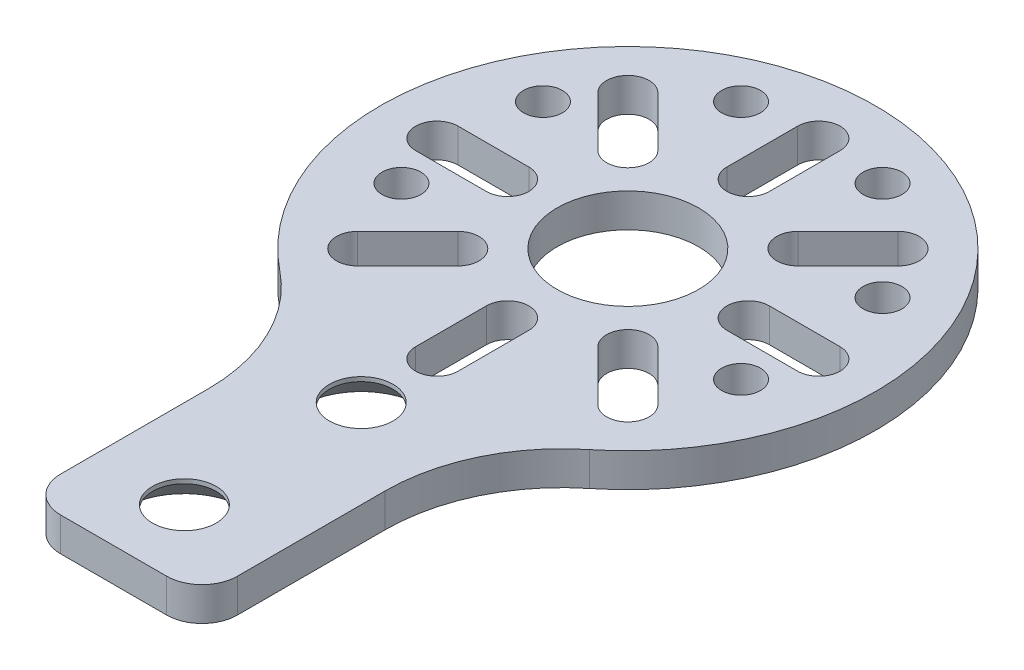
from build123d import *

# Parameters (mm, degrees)
BOSS_EXTRUDE1_DEPTH                            = 4.7625
SKETCH5_R                                      = 10
CUT_EXTRUDE1_DEPTH                             = 81.819371269
CSK_FOR_M8_FLAT_HEAD_MACHINE_SCREW1_AT_2_COUNT = 2
CSK_FOR_M8_FLAT_HEAD_MACHINE_SCREW1_AT_2_PITCH = 25
FILLET1_R                                      = 25
M5_CLEARANCE_HOLE1_D                           = 5.5
M5_CLEARANCE_HOLE1_CSINK_D                     = 5.55
M5_CLEARANCE_HOLE1_CSINK_ANGLE                 = 90
FILLET2_R                                      = 5
CUT_EXTRUDE2_DEPTH                             = 81.819371269


with BuildPart() as part:
    # Sketch1 → Boss-Extrude1 (new body)
    with BuildSketch(Plane(origin=(0, 0, 0), x_dir=(1, 0, 0), z_dir=(0, 1, 0))):
        with BuildLine():
            Line((-12.5, -72.691742077), (12.5, -72.691742077))
            Line((12.5, -72.691742077), (12.5, -32.691742077))
            ThreePointArc((12.5, -32.691742077), (0, 35), (-12.5, -32.691742077))
            Line((-12.5, -32.691742077), (-12.5, -72.691742077))
        make_face()
    extrude(amount=BOSS_EXTRUDE1_DEPTH)

    # Sketch5 → Cut-Extrude1 (cut, through all)
    with BuildSketch(Plane.XZ):
        with Locations(Location((0, 0, 0), (0, 0, 270))):
            Circle(SKETCH5_R)
    extrude(amount=-CUT_EXTRUDE1_DEPTH, mode=Mode.SUBTRACT)

    # Sketch8 → CSK for M8 Flat Head Machine Screw1 (revolve, cut)
    with BuildSketch(Plane(origin=(0, 0, 37.691742077), x_dir=(0, 0, -1), z_dir=(1, 0, 0))):
        Polygon((0, 0), (0, 4.7625), (4.5, 4.7625), (4.5, 4.15), (8.65, 0), align=None)
    csk_for_m8_flat_head_machine_screw1 = revolve(axis=Axis((0, -6.35, 37.691742077), (0, 1, 0)), mode=Mode.SUBTRACT)

    # CSK for M8 Flat Head Machine Screw1 at 2: CSK for M8 Flat Head Machine Screw1 ×2
    with Locations(*[(0, 0, i * CSK_FOR_M8_FLAT_HEAD_MACHINE_SCREW1_AT_2_PITCH) for i in range(1, CSK_FOR_M8_FLAT_HEAD_MACHINE_SCREW1_AT_2_COUNT)]):
        add(csk_for_m8_flat_head_machine_screw1, mode=Mode.SUBTRACT)

    # Fillet1
    fillet1_edges = [part.edges().sort_by_distance(p)[0] for p in [
        (-12.5, 2.38125, 32.691742077),
        (12.5, 2.38125, 32.691742077),
    ]]
    fillet(fillet1_edges, radius=FILLET1_R)

    # M5 Clearance Hole1 (through all)
    with Locations(Plane(origin=(0, 0, 0), x_dir=(-1, 0, 0), z_dir=(0, -1, 0))):
        with Locations((10, 26), (24, 12), (24, -8), (-10, 26), (-24, 12), (-24, -8)):
            CounterSinkHole(M5_CLEARANCE_HOLE1_D / 2, M5_CLEARANCE_HOLE1_CSINK_D / 2, counter_sink_angle=M5_CLEARANCE_HOLE1_CSINK_ANGLE)

    # Fillet2
    fillet2_edges = [part.edges().sort_by_distance(p)[0] for p in [
        (12.5, 2.38125, 72.691742077),
        (-12.5, 2.38125, 72.691742077),
    ]]
    fillet(fillet2_edges, radius=FILLET2_R)

    # Sketch12 → Cut-Extrude2 (cut, through all)
    with BuildSketch(Plane(origin=(0, 4.7625, 0), x_dir=(1, 0, 0), z_dir=(0, 1, 0))):
        with BuildLine():
            Line((17, 3), (27, 3))
            ThreePointArc((27, 3), (30, 0), (27, -3))
            Line((27, -3), (17, -3))
            ThreePointArc((17, -3), (14, 0), (17, 3))
        make_face()
        with BuildLine():
            Line((14.142135624, -9.899494937), (21.213203436, -16.970562748))
            ThreePointArc((21.213203436, -16.970562748), (21.213203436, -21.213203436), (16.970562748, -21.213203436))
            Line((16.970562748, -21.213203436), (9.899494937, -14.142135624))
            ThreePointArc((9.899494937, -14.142135624), (9.899494937, -9.899494937), (14.142135624, -9.899494937))
        make_face()
        with BuildLine():
            Line((3, -17), (3, -27))
            ThreePointArc((3, -27), (0, -30), (-3, -27))
            Line((-3, -27), (-3, -17))
            ThreePointArc((-3, -17), (0, -14), (3, -17))
        make_face()
        with BuildLine():
            Line((-9.899494937, -14.142135624), (-16.970562748, -21.213203436))
            ThreePointArc((-16.970562748, -21.213203436), (-21.213203436, -21.213203436), (-21.213203436, -16.970562748))
            Line((-21.213203436, -16.970562748), (-14.142135624, -9.899494937))
            ThreePointArc((-14.142135624, -9.899494937), (-9.899494937, -9.899494937), (-9.899494937, -14.142135624))
        make_face()
        with BuildLine():
            Line((-17, -3), (-27, -3))
            ThreePointArc((-27, -3), (-30, 0), (-27, 3))
            Line((-27, 3), (-17, 3))
            ThreePointArc((-17, 3), (-14, 0), (-17, -3))
        make_face()
        with BuildLine():
            Line((-14.142135624, 9.899494937), (-21.213203436, 16.970562748))
            ThreePointArc((-21.213203436, 16.970562748), (-21.213203436, 21.213203436), (-16.970562748, 21.213203436))
            Line((-16.970562748, 21.213203436), (-9.899494937, 14.142135624))
            ThreePointArc((-9.899494937, 14.142135624), (-9.899494937, 9.899494937), (-14.142135624, 9.899494937))
        make_face()
        with BuildLine():
            Line((-3, 17), (-3, 27))
            ThreePointArc((-3, 27), (0, 30), (3, 27))
            Line((3, 27), (3, 17))
            ThreePointArc((3, 17), (0, 14), (-3, 17))
        make_face()
        with BuildLine():
            Line((9.899494937, 14.142135624), (16.970562748, 21.213203436))
            ThreePointArc((16.970562748, 21.213203436), (21.213203436, 21.213203436), (21.213203436, 16.970562748))
            Line((21.213203436, 16.970562748), (14.142135624, 9.899494937))
            ThreePointArc((14.142135624, 9.899494937), (9.899494937, 9.899494937), (9.899494937, 14.142135624))
        make_face()
    extrude(amount=-CUT_EXTRUDE2_DEPTH, mode=Mode.SUBTRACT)


solid = part.part
